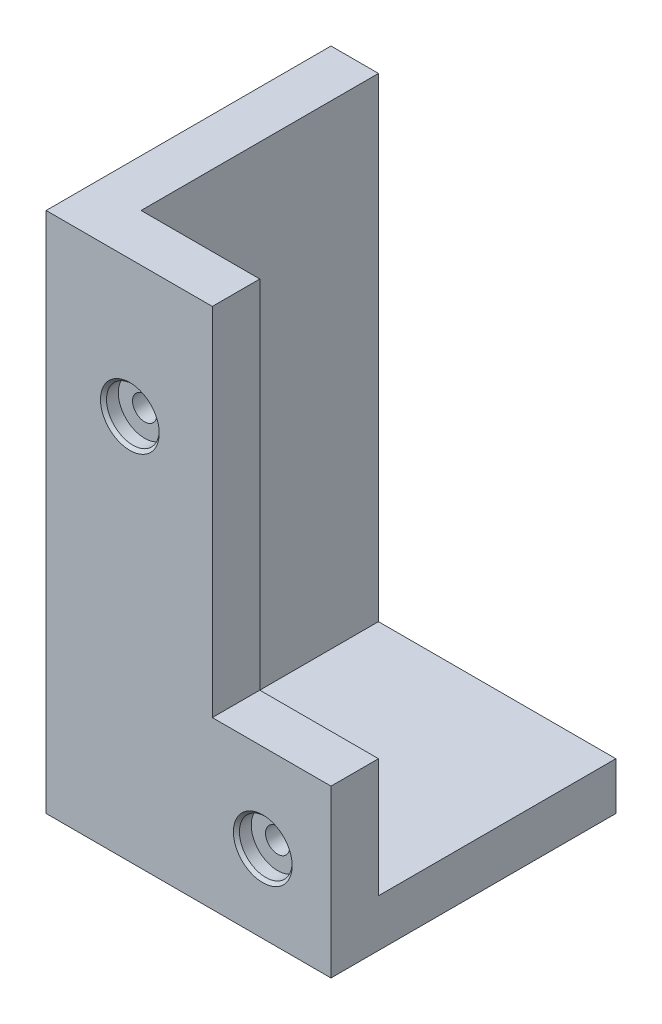
from build123d import *

# Parameters (mm, degrees)
BOSS_EXTRUDE1_DEPTH                         = 50
BOSS_EXTRUDE2_DEPTH                         = 10
CBORE_FOR_10_BINDING_HEAD_MACHINE_S_2_COUNT = 2
CBORE_FOR_10_BINDING_HEAD_MACHINE_S_2_PITCH = 70.641523205


with BuildPart() as part:
    # Sketch1 → Boss-Extrude1 (new body)
    with BuildSketch(Plane.XY):
        Polygon((0, 110), (10, 110), (10, 10), (60, 10), (60, 0), (0, 0), align=None)
    extrude(amount=BOSS_EXTRUDE1_DEPTH)

    # Sketch2 → Boss-Extrude2 (add)
    with BuildSketch(Plane.XY.offset(50)):
        Polygon((0, 110), (35, 110), (35, 35), (60, 35), (60, 0), (0, 0), align=None)
    extrude(amount=BOSS_EXTRUDE2_DEPTH)

    # Sketch3 → CBORE for #10 Binding Head Machine Screw1 (revolve, cut)
    with BuildSketch(Plane(origin=(17.635166565, 81.246186772, 60), x_dir=(0, -1, 0), z_dir=(1, 0, 0))):
        Polygon((0, 0), (0, 60.000025), (2.5527, 60.000025), (2.5527, 3.1242), (5.55625, 3.1242), (5.55625, 0.635), (6.19125, 0), align=None)
    cbore_for_10_binding_head_machine_screw = revolve(axis=Axis((17.635166565, 81.246186772, 66.35), (0, 0, -1)), mode=Mode.SUBTRACT)

    # CBORE for _10 Binding Head Machine S 2: CBORE for #10 Binding Head Machine Screw1 ×2
    with Locations(*[Vector(0.396309487955917, -0.9181169804312079, 0) * (i * CBORE_FOR_10_BINDING_HEAD_MACHINE_S_2_PITCH) for i in range(1, CBORE_FOR_10_BINDING_HEAD_MACHINE_S_2_COUNT)]):
        add(cbore_for_10_binding_head_machine_screw, mode=Mode.SUBTRACT)


solid = part.part
